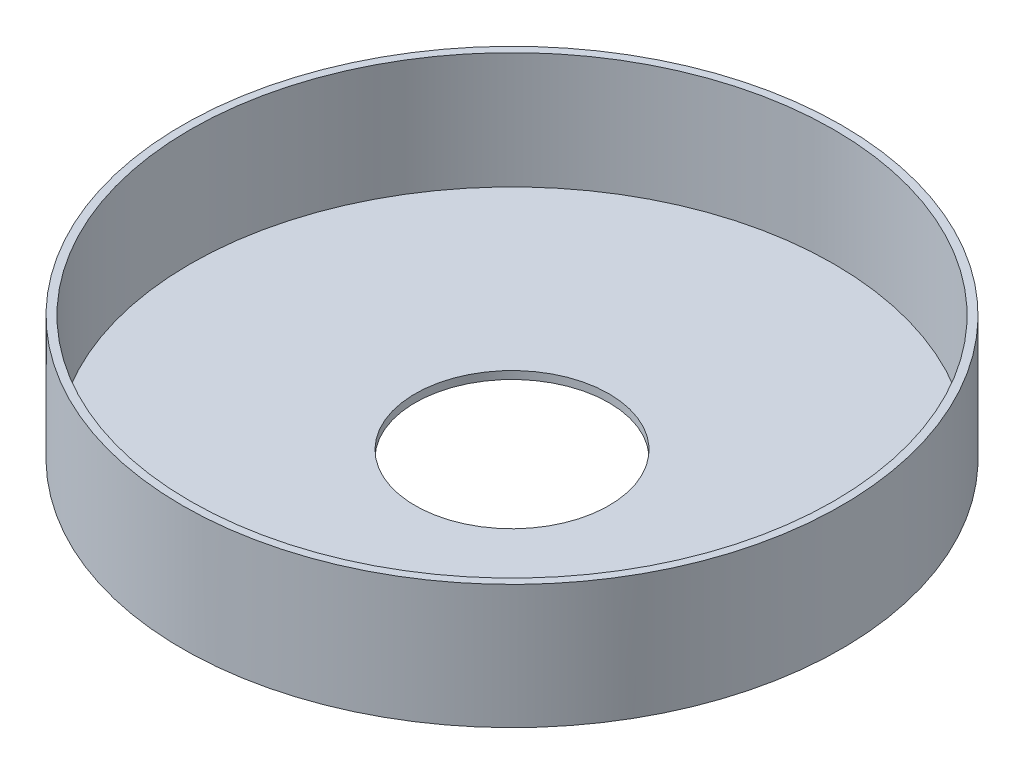
from build123d import *

# Parameters (mm, degrees)
SKETCH1_R           = 42.5
SKETCH1_R_2         = 41.5
BOSS_EXTRUDE1_DEPTH = 15
BOSS_EXTRUDE2_START = 1
SKETCH2_R           = 42.5
SKETCH2_R_2         = 12.5
BOSS_EXTRUDE2_DEPTH = 1


with BuildPart() as part:
    # Sketch1 → Boss-Extrude1 (new body)
    with BuildSketch(Plane(origin=(0, 0, 0), x_dir=(1, 0, 0), z_dir=(0, 1, 0))):
        with Locations(Location((0, 0, 0), (0, 0, 270))):
            Circle(SKETCH1_R)
        with Locations(Location((0, 0, 0), (0, 0, 270))):
            Circle(SKETCH1_R_2, mode=Mode.SUBTRACT)
    extrude(amount=BOSS_EXTRUDE1_DEPTH)

    # Sketch2 → Boss-Extrude2 (add)
    with BuildSketch(Plane.XZ.offset(BOSS_EXTRUDE2_START)):
        with Locations(Location((0, 0, 0), (0, 0, 270))):
            Circle(SKETCH2_R)
        with Locations(Location((0, 0, 0), (0, 0, 270))):
            Circle(SKETCH2_R_2, mode=Mode.SUBTRACT)
    extrude(amount=-BOSS_EXTRUDE2_DEPTH)


solid = part.part
